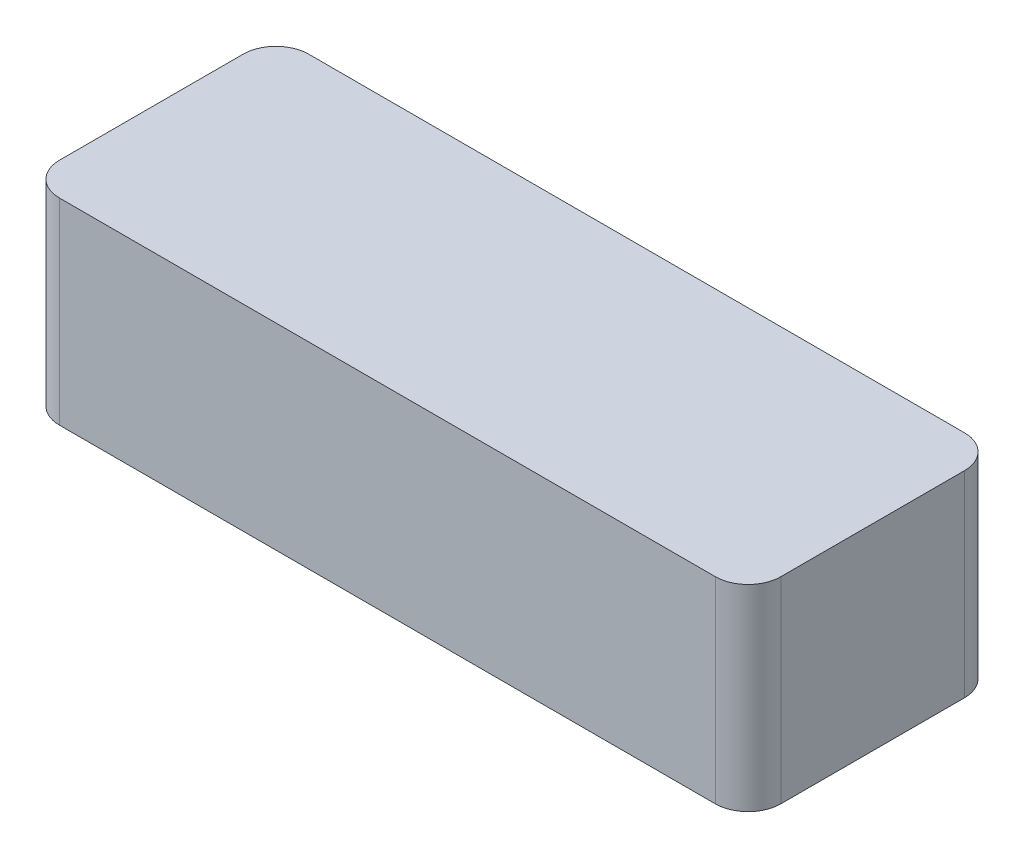
from build123d import *

# Parameters (mm, degrees)
BOSS_EXTRUDE1_DEPTH = 30


with BuildPart() as part:
    # Sketch1 → Boss-Extrude1 (new body)
    with BuildSketch(Plane(origin=(0, 0, 0), x_dir=(1, 0, 0), z_dir=(0, 1, 0))):
        with BuildLine():
            Line((-41.800436576, -14.485705951), (58.199563424, -14.485705951))
            ThreePointArc((58.199563424, -14.485705951), (61.73509733, -13.021239857), (63.199563424, -9.485705951))
            Line((63.199563424, -9.485705951), (63.199563424, 18.514294049))
            ThreePointArc((63.199563424, 18.514294049), (61.73509733, 22.049827955), (58.199563424, 23.514294049))
            Line((58.199563424, 23.514294049), (-41.800436576, 23.514294049))
            ThreePointArc((-41.800436576, 23.514294049), (-45.335970482, 22.049827955), (-46.800436576, 18.514294049))
            Line((-46.800436576, 18.514294049), (-46.800436576, -9.485705951))
            ThreePointArc((-46.800436576, -9.485705951), (-45.335970482, -13.021239857), (-41.800436576, -14.485705951))
        make_face()
    extrude(amount=BOSS_EXTRUDE1_DEPTH)


solid = part.part
